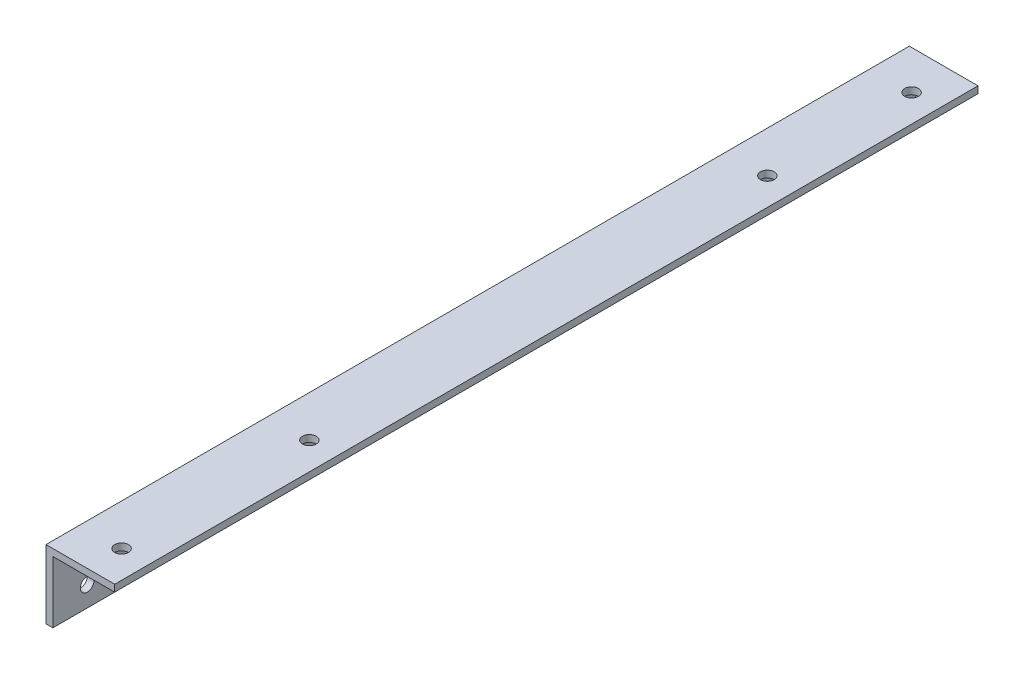
from build123d import *

# Parameters (mm, degrees)
EXTRUSION1_DEPTH = 188.5
ESQUISSE2_R      = 1.5
EXTRUSION2_DEPTH = 267
ESQUISSE3_R      = 1.5
ESQUISSE3_R_2    = 1.723102606
EXTRUSION3_DEPTH = 10


with BuildPart() as part:
    # Esquisse1 → Extrusion1 (new body)
    with BuildSketch(Plane.XY):
        Polygon((-19.477054801, -9.635894737), (-19.477054801, -24.635894737), (-17.977054801, -24.635894737), (-17.977054801, -11.135894737), (-4.477054801, -11.135894737), (-4.477054801, -9.635894737), align=None)
    extrude(amount=EXTRUSION1_DEPTH)

    # Esquisse2 → Extrusion2 (cut)
    with BuildSketch(Plane(origin=(0, -9.635894737, 0), x_dir=(-1, 0, 0), z_dir=(0, 1, 0))):
        with Locations((10.477054801, 8.5)):
            Circle(ESQUISSE2_R)
        with Locations((10.477054801, 181)):
            Circle(ESQUISSE2_R)
        with Locations((10.477054801, 140)):
            Circle(ESQUISSE2_R)
        with Locations((10.477054801, 40)):
            Circle(ESQUISSE2_R)
    extrude(amount=-EXTRUSION2_DEPTH, mode=Mode.SUBTRACT)

    # Esquisse3 → Extrusion3 (cut)
    with BuildSketch(Plane(origin=(-17.977054801, 0, 0), x_dir=(0, 0, -1), z_dir=(1, 0, 0))):
        with Locations((-40, -20.135894737)):
            Circle(ESQUISSE3_R)
        with Locations((-140, -20.135894737)):
            Circle(ESQUISSE3_R)
        with Locations((-181, -20.135894737)):
            Circle(ESQUISSE3_R)
        with Locations((-7.5, -17.135894737)):
            Circle(ESQUISSE3_R_2)
    extrude(amount=-EXTRUSION3_DEPTH, mode=Mode.SUBTRACT)


solid = part.part
